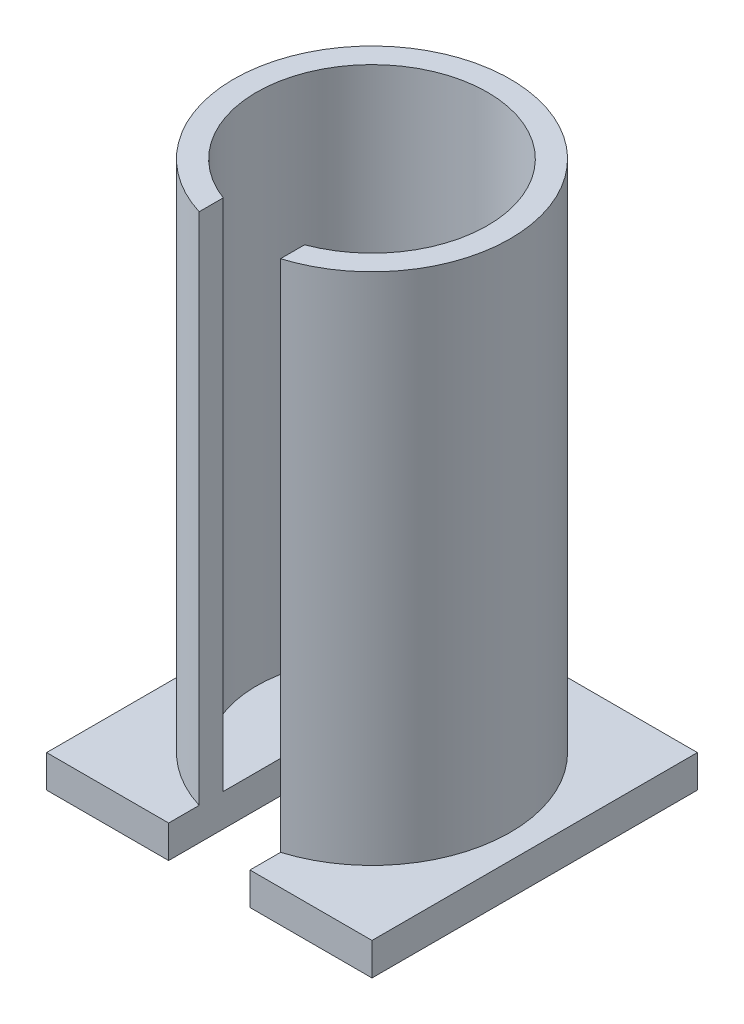
from build123d import *

# Parameters (mm, degrees)
SKETCH1_R           = 4.25
SKETCH1_R_2         = 3.55
BOSS_EXTRUDE1_DEPTH = 16.8
SKETCH2_R           = 3.55
SKETCH2_R_2         = 1.25
BOSS_EXTRUDE2_DEPTH = 1
CUT_EXTRUDE1_DEPTH  = 18
BOSS_EXTRUDE3_DEPTH = 1


with BuildPart() as part:
    # Sketch1 → Boss-Extrude1 (new body)
    with BuildSketch(Plane(origin=(0, 0, 0), x_dir=(1, 0, 0), z_dir=(0, 1, 0))):
        with Locations(Location((0, 0, 0), (0, 0, 270))):
            Circle(SKETCH1_R)
        with Locations(Location((0, 0, 0), (0, 0, 270))):
            Circle(SKETCH1_R_2, mode=Mode.SUBTRACT)
    extrude(amount=BOSS_EXTRUDE1_DEPTH)

    # Sketch2 → Boss-Extrude2 (add)
    with BuildSketch(Plane(origin=(0, 0, 0), x_dir=(1, 0, 0), z_dir=(0, 1, 0))):
        with Locations(Location((0, 0, 0), (0, 0, 270))):
            Circle(SKETCH2_R)
        with Locations(Location((0, 0, 0), (0, 0, 270))):
            Circle(SKETCH2_R_2, mode=Mode.SUBTRACT)
    extrude(amount=BOSS_EXTRUDE2_DEPTH)

    # Sketch3 → Cut-Extrude1 (cut)
    with BuildSketch(Plane(origin=(0, 0, 0), x_dir=(1, 0, 0), z_dir=(0, 1, 0))):
        with BuildLine():
            ThreePointArc((1.25, 0), (0, -1.25), (-1.25, 0))
            Line((-1.25, 0), (-1.25, -5.072282681))
            Line((-1.25, -5.072282681), (1.25, -5.072282681))
            Line((1.25, -5.072282681), (1.25, 0))
        make_face()
    extrude(amount=CUT_EXTRUDE1_DEPTH, mode=Mode.SUBTRACT)

    # Sketch4 → Boss-Extrude3 (add)
    with BuildSketch(Plane(origin=(0, 0, 0), x_dir=(1, 0, 0), z_dir=(0, 1, 0))):
        with BuildLine():
            Line((-1.25, -5), (-1.25, 0))
            ThreePointArc((-1.25, 0), (0, 1.25), (1.25, 0))
            Line((1.25, 0), (1.25, -5))
            Line((1.25, -5), (5, -5))
            Line((5, -5), (5, 5))
            Line((5, 5), (-5, 5))
            Line((-5, 5), (-5, -5))
            Line((-5, -5), (-1.25, -5))
        make_face()
    extrude(amount=BOSS_EXTRUDE3_DEPTH)


solid = part.part
